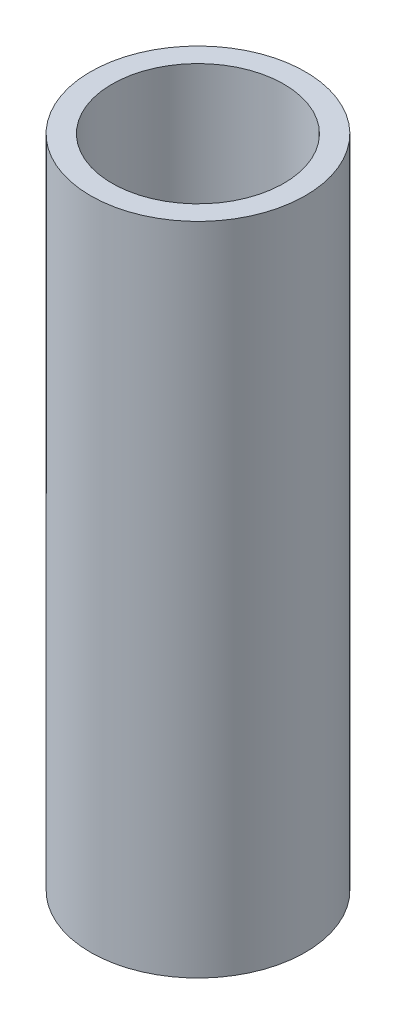
from build123d import *

# Parameters (mm, degrees)
SKETCH1_R           = 10
SKETCH1_R_2         = 2.65
BOSS_EXTRUDE1_DEPTH = 3
SKETCH2_R           = 10
SKETCH2_R_2         = 8
BOSS_EXTRUDE2_DEPTH = 58


with BuildPart() as part:
    # Sketch1 → Boss-Extrude1 (new body)
    with BuildSketch(Plane(origin=(0, 0, 0), x_dir=(1, 0, 0), z_dir=(0, 1, 0))):
        with Locations(Location((0, 0, 0), (0, 0, 270))):
            Circle(SKETCH1_R)
        with Locations(Location((0, 0, 0), (0, 0, 270))):
            Circle(SKETCH1_R_2, mode=Mode.SUBTRACT)
    extrude(amount=BOSS_EXTRUDE1_DEPTH)

    # Sketch2 → Boss-Extrude2 (add)
    with BuildSketch(Plane(origin=(0, 3, 0), x_dir=(1, 0, 0), z_dir=(0, 1, 0))):
        with Locations(Location((0, 0, 0), (0, 0, 270))):
            Circle(SKETCH2_R)
        with Locations(Location((0, 0, 0), (0, 0, 90))):
            Circle(SKETCH2_R_2, mode=Mode.SUBTRACT)
    extrude(amount=BOSS_EXTRUDE2_DEPTH)


solid = part.part
